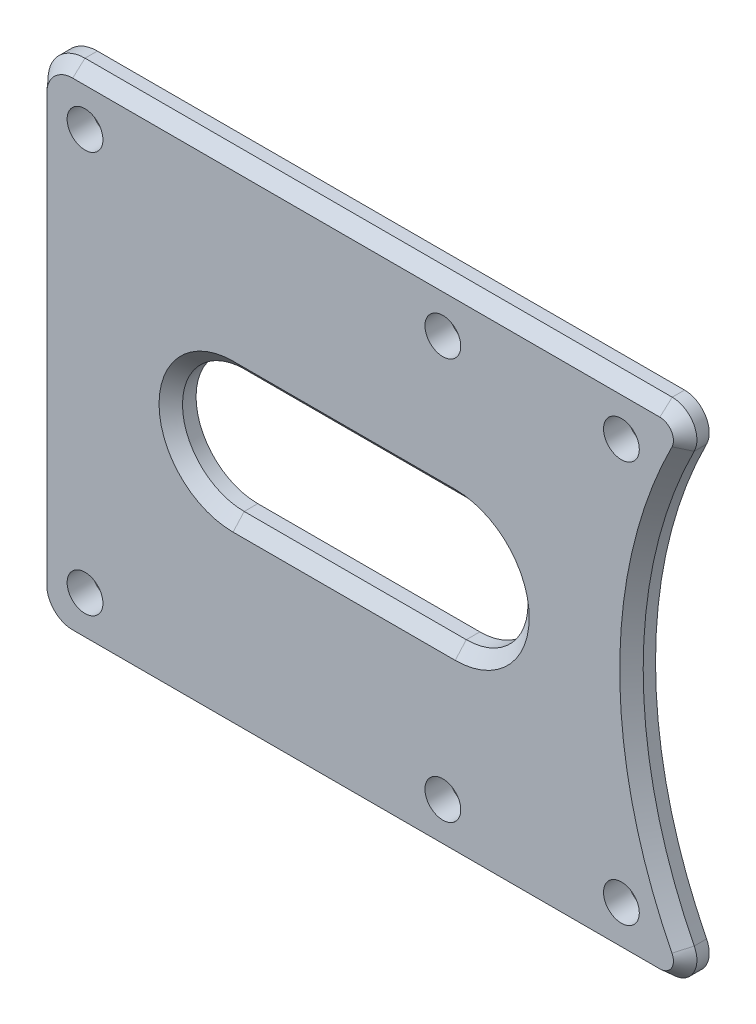
from build123d import *
from OCP.BRepFilletAPI import BRepFilletAPI_MakeChamfer

# Parameters (mm, degrees)
SKETCH_2_R      = 1.45
EXTRUDE_1_DEPTH = 2
CHAMFER_2_SIZE  = 1
CHAMFER_2_SIZE2 = 0.900404044
CHAMFER_3_SIZE  = 1
CHAMFER_3_SIZE2 = 0.900404044


with BuildPart() as part:
    # 草图2 → 凸台-拉伸1 (new body)
    with BuildSketch(Plane.XY):
        with BuildLine():
            Line((148.264880132, -17.264045876), (148.264880132, 17.264045876))
            ThreePointArc((148.264880132, 17.264045876), (149.143559788, 19.385366219), (151.264880132, 20.264045876))
            Line((151.264880132, 20.264045876), (198.85204531, 20.264045876))
            ThreePointArc((198.85204531, 20.264045876), (200.555549989, 19.311935091), (200.637129492, 17.362117684))
            ThreePointArc((200.637129492, 17.362117684), (196.5, 0), (200.637129492, -17.362117684))
            ThreePointArc((200.637129492, -17.362117684), (200.555549989, -19.311935091), (198.85204531, -20.264045876))
            Line((198.85204531, -20.264045876), (151.264880132, -20.264045876))
            ThreePointArc((151.264880132, -20.264045876), (149.143559788, -19.385366219), (148.264880132, -17.264045876))
        make_face()
        with Locations((152.264880132, 16.264045876)):
            Circle(SKETCH_2_R, mode=Mode.SUBTRACT)
        with Locations((181.264880132, 16.264045876)):
            Circle(SKETCH_2_R, mode=Mode.SUBTRACT)
        with Locations((195.735119868, 16.264045876)):
            Circle(SKETCH_2_R, mode=Mode.SUBTRACT)
        with Locations((152.264880132, -16.264045876)):
            Circle(SKETCH_2_R, mode=Mode.SUBTRACT)
        with Locations((181.264880132, -16.264045876)):
            Circle(SKETCH_2_R, mode=Mode.SUBTRACT)
        with Locations((195.735119868, -16.264045876)):
            Circle(SKETCH_2_R, mode=Mode.SUBTRACT)
        with BuildLine():
            Line((164.264880132, 5), (182.264880132, 5))
            ThreePointArc((182.264880132, 5), (187.264880132, 0), (182.264880132, -5))
            Line((182.264880132, -5), (164.264880132, -5))
            ThreePointArc((164.264880132, -5), (159.264880132, 0), (164.264880132, 5))
        make_face(mode=Mode.SUBTRACT)
    extrude(amount=EXTRUDE_1_DEPTH)

    # 倒角2: one chamfer whose edges measure the first distance from different faces: ONE call of the kernel's chamfer builder (chamfer() names one face for all edges)
    chamfer_2_edges_1 = [part.edges().sort_by_distance(p)[0] for p in [
        (200.555549989, -19.311935091, 2),
    ]]
    chamfer_2_side_1 = [part.faces().sort_by_distance(p)[0] for p in [
        (200.555549989, -19.311935091, 1),
    ]]
    chamfer_2_edges_2 = [part.edges().sort_by_distance(p)[0] for p in [
        (196.5, 0, 2),
    ]]
    chamfer_2_side_2 = [part.faces().sort_by_distance(p)[0] for p in [
        (196.5, 0, 1),
    ]]
    chamfer_2_edges_3 = [part.edges().sort_by_distance(p)[0] for p in [
        (200.555549989, 19.311935091, 2),
    ]]
    chamfer_2_side_3 = [part.faces().sort_by_distance(p)[0] for p in [
        (200.555549989, 19.311935091, 1),
    ]]
    chamfer_2_edges_4 = [part.edges().sort_by_distance(p)[0] for p in [
        (175.058462721, 20.264045876, 2),
    ]]
    chamfer_2_side_4 = [part.faces().sort_by_distance(p)[0] for p in [
        (175.058462721, 20.264045876, 1),
    ]]
    chamfer_2_edges_5 = [part.edges().sort_by_distance(p)[0] for p in [
        (149.143559788, 19.385366219, 2),
    ]]
    chamfer_2_side_5 = [part.faces().sort_by_distance(p)[0] for p in [
        (149.143559788, 19.385366219, 1),
    ]]
    chamfer_2_edges_6 = [part.edges().sort_by_distance(p)[0] for p in [
        (148.264880132, 0, 2),
    ]]
    chamfer_2_side_6 = [part.faces().sort_by_distance(p)[0] for p in [
        (148.264880132, 0, 1),
    ]]
    chamfer_2_edges_7 = [part.edges().sort_by_distance(p)[0] for p in [
        (149.143559788, -19.385366219, 2),
    ]]
    chamfer_2_side_7 = [part.faces().sort_by_distance(p)[0] for p in [
        (149.143559788, -19.385366219, 1),
    ]]
    chamfer_2_edges_8 = [part.edges().sort_by_distance(p)[0] for p in [
        (175.058462721, -20.264045876, 2),
    ]]
    chamfer_2_side_8 = [part.faces().sort_by_distance(p)[0] for p in [
        (175.058462721, -20.264045876, 1),
    ]]
    chamfer_2 = BRepFilletAPI_MakeChamfer(part.part.solid().wrapped)
    for e in chamfer_2_edges_1:
        chamfer_2.Add(CHAMFER_2_SIZE, CHAMFER_2_SIZE2, e.wrapped, chamfer_2_side_1[0].wrapped)  # the first distance lies on this face
    for e in chamfer_2_edges_2:
        chamfer_2.Add(CHAMFER_2_SIZE, CHAMFER_2_SIZE2, e.wrapped, chamfer_2_side_2[0].wrapped)  # the first distance lies on this face
    for e in chamfer_2_edges_3:
        chamfer_2.Add(CHAMFER_2_SIZE, CHAMFER_2_SIZE2, e.wrapped, chamfer_2_side_3[0].wrapped)  # the first distance lies on this face
    for e in chamfer_2_edges_4:
        chamfer_2.Add(CHAMFER_2_SIZE, CHAMFER_2_SIZE2, e.wrapped, chamfer_2_side_4[0].wrapped)  # the first distance lies on this face
    for e in chamfer_2_edges_5:
        chamfer_2.Add(CHAMFER_2_SIZE, CHAMFER_2_SIZE2, e.wrapped, chamfer_2_side_5[0].wrapped)  # the first distance lies on this face
    for e in chamfer_2_edges_6:
        chamfer_2.Add(CHAMFER_2_SIZE, CHAMFER_2_SIZE2, e.wrapped, chamfer_2_side_6[0].wrapped)  # the first distance lies on this face
    for e in chamfer_2_edges_7:
        chamfer_2.Add(CHAMFER_2_SIZE, CHAMFER_2_SIZE2, e.wrapped, chamfer_2_side_7[0].wrapped)  # the first distance lies on this face
    for e in chamfer_2_edges_8:
        chamfer_2.Add(CHAMFER_2_SIZE, CHAMFER_2_SIZE2, e.wrapped, chamfer_2_side_8[0].wrapped)  # the first distance lies on this face
    add(Compound.cast(chamfer_2.Shape()), mode=Mode.REPLACE)

    # 倒角3
    chamfer_3_edges = [part.edges().sort_by_distance(p)[0] for p in [
        (159.264880132, 0, 2),
        (173.264880132, -5, 2),
        (187.264880132, 0, 2),
        (173.264880132, 5, 2),
    ]]
    chamfer_3_side = [part.faces().sort_by_distance(p)[0] for p in [
        (199.244635879, -18.505542966, 2),
    ]]
    chamfer(chamfer_3_edges, length=CHAMFER_3_SIZE, length2=CHAMFER_3_SIZE2, reference=chamfer_3_side[0])


solid = part.part
